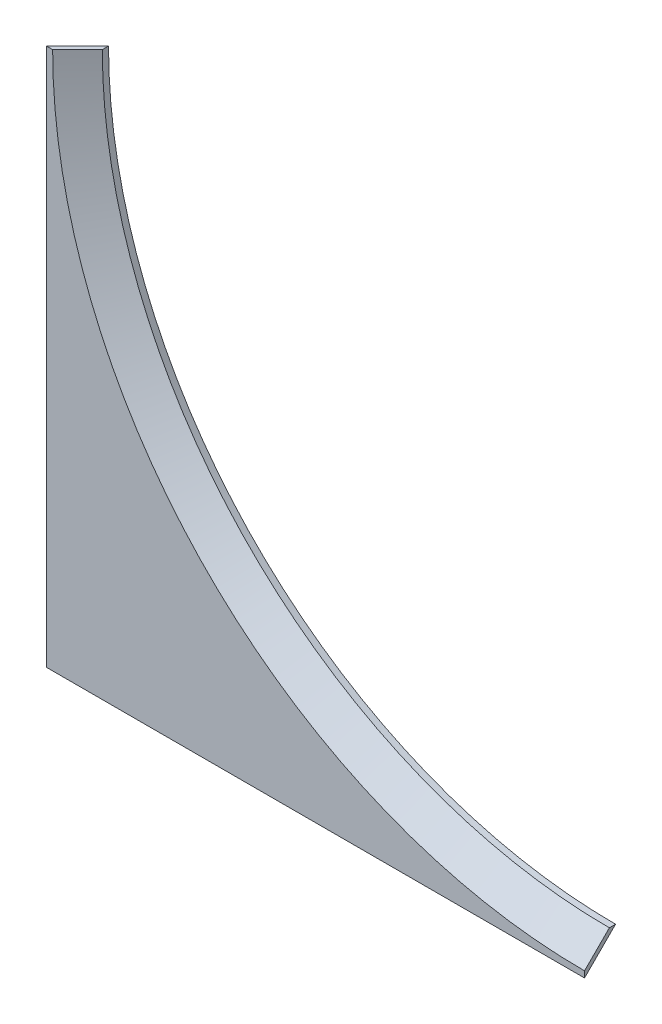
from build123d import *

# Parameters (mm, degrees)
BOSS_EXTRUDE1_DEPTH = 15
BOSS_EXTRUDE2_DEPTH = 245
BOSS_EXTRUDE3_DEPTH = 245
BOSS_EXTRUDE4_DEPTH = 245
CUT_EXTRUDE1_DEPTH  = 245
CHAMFER1_SIZE       = 12


with BuildPart() as part:
    # Sketch1 → Boss-Extrude1 (new body)
    with BuildSketch(Plane.XY):
        with BuildLine():
            Line((15, 15), (260, 15))
            ThreePointArc((260, 15), (86.758838609, 86.758838609), (15, 260))
            Line((15, 260), (15, 15))
        make_face()
    extrude(amount=BOSS_EXTRUDE1_DEPTH)

    # Sketch2 → Boss-Extrude2 (add)
    with BuildSketch(Plane.XZ.offset(-15)):
        Polygon((15, 0), (0, 15), (15, 15), align=None)
    extrude(amount=-BOSS_EXTRUDE2_DEPTH)

    # Sketch3 → Boss-Extrude3 (add)
    with BuildSketch(Plane(origin=(15, 0, 0), x_dir=(0, 0, -1), z_dir=(1, 0, 0))):
        Polygon((0, 15), (-15, 0), (-15, 15), align=None)
    extrude(amount=BOSS_EXTRUDE3_DEPTH)

    # Sketch4 → Boss-Extrude4 (add)
    with BuildSketch(Plane.ZY.offset(-15)):
        Polygon((15, 15), (0, 15), (15, 0), align=None)
    extrude(amount=BOSS_EXTRUDE4_DEPTH)

    # Sketch5 → Cut-Extrude1 (cut)
    with BuildSketch(Plane(origin=(0, 15, 0), x_dir=(1, 0, 0), z_dir=(0, 1, 0))):
        Polygon((0, -15), (15, 0), (-230, 0), (-230, -15), align=None)
    extrude(amount=-CUT_EXTRUDE1_DEPTH, mode=Mode.SUBTRACT)

    # Chamfer1
    chamfer1_edges = [part.edges().sort_by_distance(p)[0] for p in [
        (86.758838609, 86.758838609, 15),
    ]]
    chamfer(chamfer1_edges, length=CHAMFER1_SIZE)


solid = part.part
